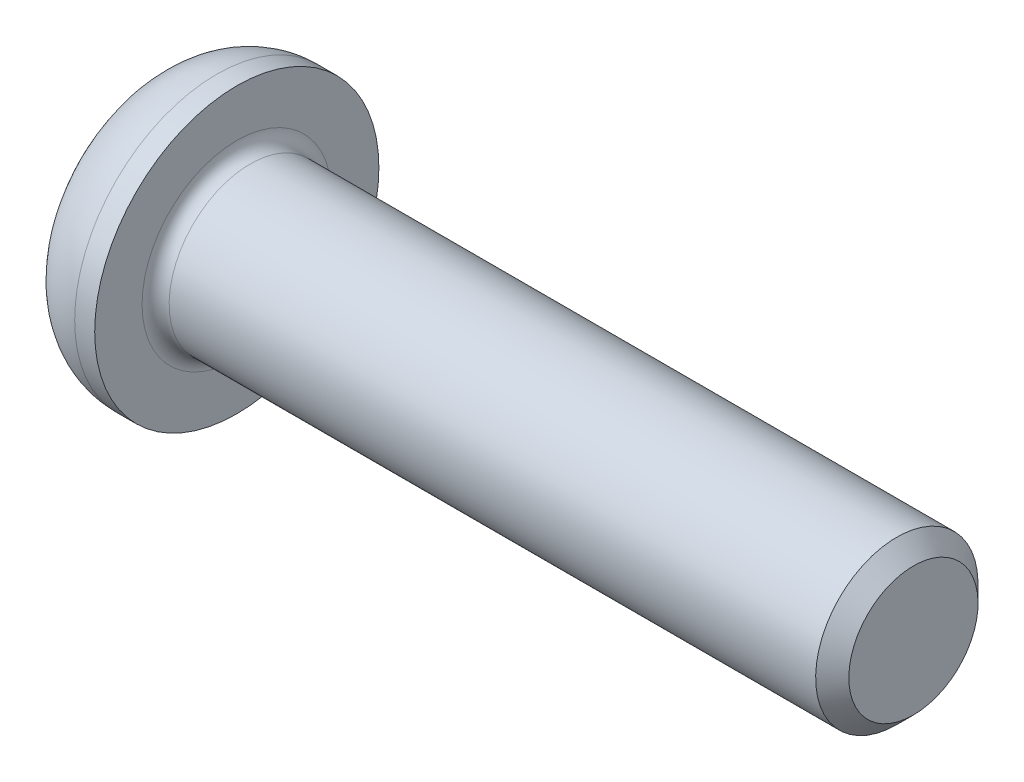
from build123d import *

# Parameters (mm, degrees)
EXTRUDE_562_REACH = 31.258
SKETCH_2_R        = 2.309401077
FILLET_616_R      = 2.56
CHAMFER_1_SIZE    = 0.61345
FILLET_2_R        = 0.5


with BuildPart() as part:
    # 草圖1 → Revolve 435 (revolve)
    with BuildSketch(Plane.XY, mode=Mode.PRIVATE) as revolve_435_sk:
        Polygon((0.113333333, 0), (25, 0), (25, 3), (3, 3), (2.38645, 3), (0, 3), (0, 5.25), (-3.3, 5.25), (-3.3, 2.309401077), (-1.22, 2.309401077), align=None)
    revolve(revolve_435_sk.sketch.rotate(Axis((0.113333333, 0, 0), (1, 0, 0)), 180), axis=Axis((0.113333333, 0, 0), (1, 0, 0)))

    # 草圖2 → Extrude 562 (add, up to next)
    with BuildSketch(Plane.ZY.offset(3.3), mode=Mode.PRIVATE) as extrude_562_sk1:
        Circle(SKETCH_2_R)
    extrude_562_tool1 = extrude(extrude_562_sk1.sketch, amount=-EXTRUDE_562_REACH, mode=Mode.PRIVATE) - part.part
    # 草圖2 → Extrude 562 (add, up to next)
    with BuildSketch(Plane.ZY.offset(3.3), mode=Mode.PRIVATE) as extrude_562_sk2:
        Polygon((2.309401077, 0), (1.154700538, -2), (-1.154700538, -2), (-2.309401077, 0), (-1.154700538, 2), (1.154700538, 2), align=None)
    extrude_562_tool2 = extrude(extrude_562_sk2.sketch, amount=-EXTRUDE_562_REACH, mode=Mode.PRIVATE) - part.part
    add(extrude_562_tool1.solids().sort_by_distance((-3.3, 0, 0))[0])
    add(extrude_562_tool2.solids().sort_by_distance((-3.3, 0, 0))[0])

    # Fillet 616
    fillet_616_edges = [part.edges().sort_by_distance(p)[0] for p in [
        (-3.3, 5.25, 0),
    ]]
    fillet(fillet_616_edges, radius=FILLET_616_R)

    # 倒角1
    chamfer_1_edges = [part.edges().sort_by_distance(p)[0] for p in [
        (25, 3, 0),
    ]]
    chamfer(chamfer_1_edges, length=CHAMFER_1_SIZE)

    # 圓角2
    fillet_2_edges = [part.edges().sort_by_distance(p)[0] for p in [
        (0, 3, 0),
    ]]
    fillet(fillet_2_edges, radius=FILLET_2_R)


solid = part.part
